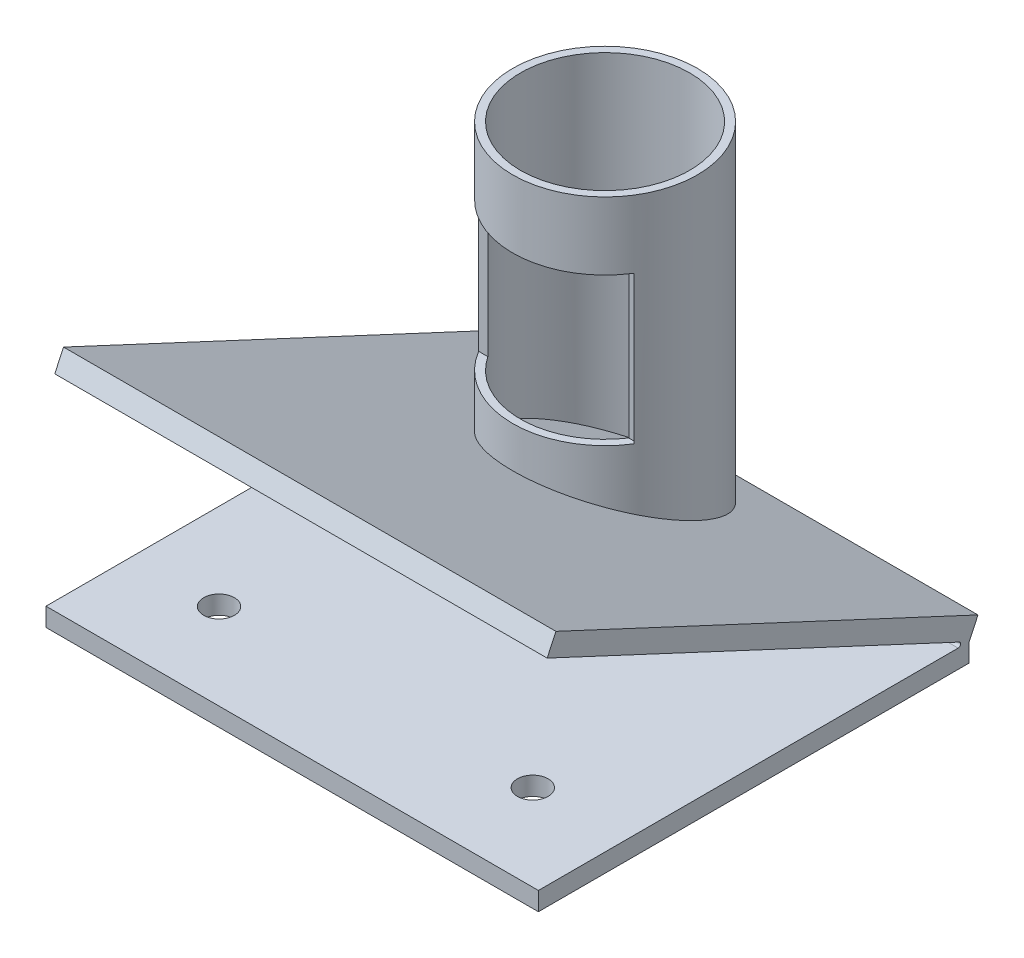
from build123d import *

# Parameters (mm, degrees)
BOSS_EXTRUDE1_DEPTH = 400
SKETCH3_R           = 29.999999999999996
CUT_EXTRUDE1_DEPTH  = 5
SKETCH4_R           = 12.46239114177459
SKETCH4_R_2         = 12.462391141774633
CUT_EXTRUDE2_DEPTH  = 25
SKETCH5_R           = 75.00000000000003
SKETCH5_R_2         = 68.68991189678029
BOSS_EXTRUDE3_DEPTH = 300
CUT_EXTRUDE3_START  = -500
CUT_EXTRUDE3_DEPTH  = 500
CUT_EXTRUDE4_DEPTH  = 50


with BuildPart() as part:
    # Sketch2 → Boss-Extrude1 (new body)
    with BuildSketch(Plane(origin=(0, 0, 0), x_dir=(0, 0, -1), z_dir=(1, 0, 0))):
        with BuildLine():
            Line((166.82381951615696, 11.312615574073371), (-167.875551318356, 167.38549537386393))
            Line((-167.875551318356, 167.38549537386393), (-160.75110263671203, 182.66392487646505))
            Line((-160.75110263671203, 182.66392487646505), (182.12444868164403, 22.778429502601124))
            Line((182.12444868164403, 22.778429502601124), (174.99999999999997, 7.500000000000001))
            Line((174.99999999999997, 7.500000000000001), (174.99999999999997, -7.499999999999999))
            Line((174.99999999999997, -7.499999999999999), (-175.00000000000003, -7.499999999999999))
            Line((-175.00000000000003, -7.499999999999999), (-175.00000000000003, 7.500000000000001))
            Line((-175.00000000000003, 7.500000000000001), (165.97858299267557, 7.500000000000001))
            ThreePointArc((165.97858299267557, 7.500000000000001), (167.9311750069156, 9.067120772123808), (166.82381951615696, 11.312615574073371))
        make_face()
    extrude(amount=-BOSS_EXTRUDE1_DEPTH)

    # Sketch3 → Cut-Extrude1 (cut)
    with BuildSketch(Plane.XZ.offset(7.499999999999999)):
        with Locations(Location((-200, 0, 0), (0, 0, 270))):
            Circle(SKETCH3_R)
    extrude(amount=-CUT_EXTRUDE1_DEPTH, mode=Mode.SUBTRACT)

    # Sketch4 → Cut-Extrude2 (cut)
    with BuildSketch(Plane.XZ.offset(7.499999999999999)):
        with Locations(Location((-329.47757363975893, 104.93281760237586, 0), (0, 0, 270))):
            Circle(SKETCH4_R)
        with Locations(Location((-74.6165788863995, 104.93281760237586, 0), (0, 0, 270))):
            Circle(SKETCH4_R_2)
    extrude(amount=-CUT_EXTRUDE2_DEPTH, mode=Mode.SUBTRACT)


with BuildPart() as body_2:
    # Sketch5 → Boss-Extrude3 (new body)
    with BuildSketch(Plane(origin=(0, 7.500000000000001, 0), x_dir=(1, 0, 0), z_dir=(0, 1, 0))):
        with Locations(Location((-213.81776477578452, 92.9785829926757, 0), (0, 0, 270))):
            Circle(SKETCH5_R)
        with Locations(Location((-213.81776477578452, 92.9785829926757, 0), (0, 0, 270))):
            Circle(SKETCH5_R_2, mode=Mode.SUBTRACT)
    extrude(amount=BOSS_EXTRUDE3_DEPTH)

    # Sketch6 → Cut-Extrude3 (cut)
    with BuildSketch(Plane.ZY.offset(400).offset(CUT_EXTRUDE3_START)):
        with BuildLine():
            Line((0.5258659010995148, 89.34905547396865), (-166.82381951615696, 11.31261557407337))
            ThreePointArc((-166.82381951615696, 11.31261557407337), (-167.9311750069156, 9.067120772123864), (-165.97858299267568, 7.5))
            Line((-165.97858299267568, 7.5), (-3.0663718706783194, 7.500000000000001))
            Line((-3.0663718706783194, 7.500000000000001), (0.5258659010995148, 89.34905547396865))
        make_face()
    extrude(amount=CUT_EXTRUDE3_DEPTH, mode=Mode.SUBTRACT)


with BuildPart() as cut_extrude3_piece_1:
    # of the separate pieces the step leaves, piece 1, a body of its own (cut_extrude3_pieces)
    add(body_2.part.solids().sort_by_distance((-200.707423713, 11.312615574, -166.823819516))[0])

    # Sketch8 → Cut-Extrude4 (cut)
    with BuildSketch(Plane.XY.offset(-4.999999999999977)):
        Polygon((-280.3769731102271, 252.5305411121489), (-150.37697311022706, 252.5305411121489), (-150.37697311022706, 132.53054111214894), (-280.376973110227, 132.5305411121489), align=None)
    extrude(amount=-CUT_EXTRUDE4_DEPTH, mode=Mode.SUBTRACT)


with BuildPart() as cut_extrude3_piece_2:
    # of the separate pieces the step leaves, piece 2, a body of its own (cut_extrude3_pieces)
    add(body_2.part.solids().sort_by_distance((-196.613114242, 7.5, -165.978582993))[0])


solid = Compound([part.part, cut_extrude3_piece_1.part, cut_extrude3_piece_2.part])
